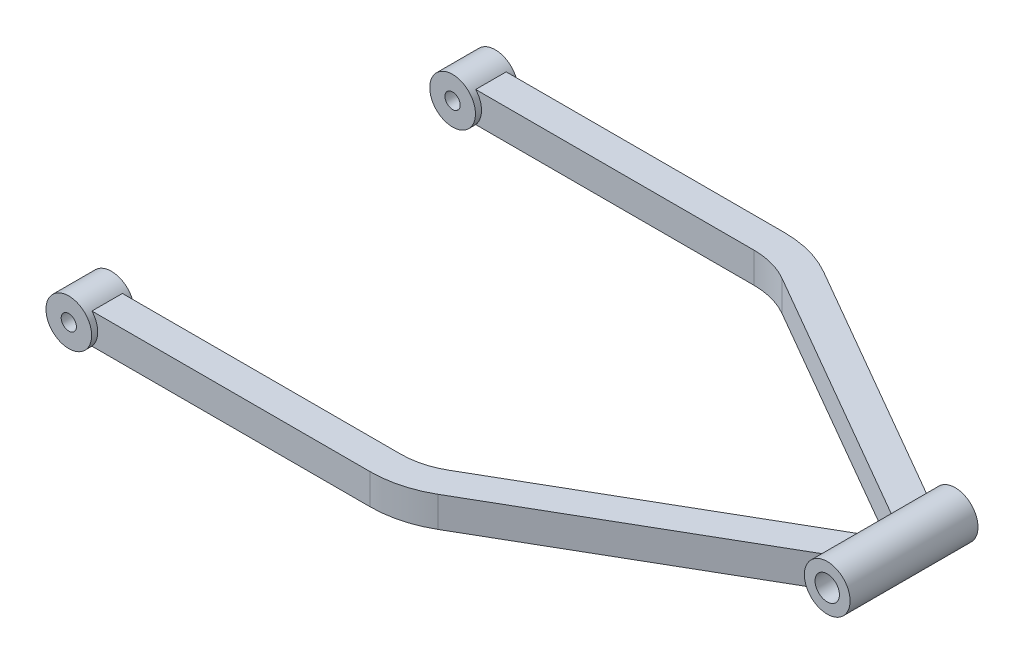
from build123d import *

# Parameters (mm, degrees)
SKETCH2_R               = 7.5
SKETCH2_R_2             = 2.5
BOSS_EXTRUDE1_DEPTH     = 7
SKETCH4_R               = 7.5
SKETCH4_R_2             = 4
BOSS_EXTRUDE2_DEPTH     = 21
SKETCH3_W               = 10
SKETCH3_H               = 10
CUT_EXTRUDE1_DEPTH      = 137
CUT_EXTRUDE1_DEPTH_BACK = 20
SKETCH2_2_R             = 2.5
SKETCH4_2_R             = 4
CUT_EXTRUDE2_DEPTH      = 30


with BuildPart() as part:
    # Sketch2 → Boss-Extrude1 (new, symmetric)
    with BuildSketch(Plane.XY.offset(-63)):
        Circle(SKETCH2_R)
        Circle(SKETCH2_R_2, mode=Mode.SUBTRACT)
    boss_extrude1 = extrude(amount=BOSS_EXTRUDE1_DEPTH, both=True)



with BuildPart() as body_2:
    # Sketch4 → Boss-Extrude2 (new, symmetric)
    with BuildSketch(Plane.XY):
        with Locations((200, 0)):
            Circle(SKETCH4_R)
        with Locations((200, 0)):
            Circle(SKETCH4_R_2, mode=Mode.SUBTRACT)
    extrude(amount=BOSS_EXTRUDE2_DEPTH, both=True)


with BuildPart() as part_1:
    add(part.part)

    add(body_2.part)  # Sweep1 merges body 2
    # Sweep1: sweep along a path in Sketch1
    with BuildLine(Plane(origin=(0, 0, 0), x_dir=(1, 0, 0), z_dir=(0, 1, 0))) as sweep1_path:
        Line((0, 63), (96.961524227, 63))
        ThreePointArc((96.961524227, 63), (104.72609558, 61.977774789), (111.961524227, 58.980762114))
        Line((111.961524227, 58.980762114), (200, 8.151724427))
    # Sketch3 → Sweep1 (sweep)
    with BuildSketch(Plane(origin=(0, 0, -63), x_dir=(0, 0, -1), z_dir=(1, 0, 0))):
        Rectangle(SKETCH3_W, SKETCH3_H)
    sweep1 = sweep(path=sweep1_path.line)

    # Mirror1: Boss-Extrude1, Sweep1 across plane
    add(boss_extrude1.mirror(Plane.XY))
    add(sweep1.mirror(Plane.XY))

    # Sketch2<2> → Cut-Extrude1 (cut, two sides: drawn at the far end of the back side and taken through both)
    with BuildSketch(Plane.XY.offset(-63).offset(-CUT_EXTRUDE1_DEPTH_BACK)):
        Circle(SKETCH2_2_R)
    extrude(amount=CUT_EXTRUDE1_DEPTH + CUT_EXTRUDE1_DEPTH_BACK, mode=Mode.SUBTRACT)

    # Sketch4<2> → Cut-Extrude2 (cut, symmetric)
    with BuildSketch(Plane.XY):
        with Locations((200, 0)):
            Circle(SKETCH4_2_R)
    extrude(amount=CUT_EXTRUDE2_DEPTH, both=True, mode=Mode.SUBTRACT)


solid = part_1.part
